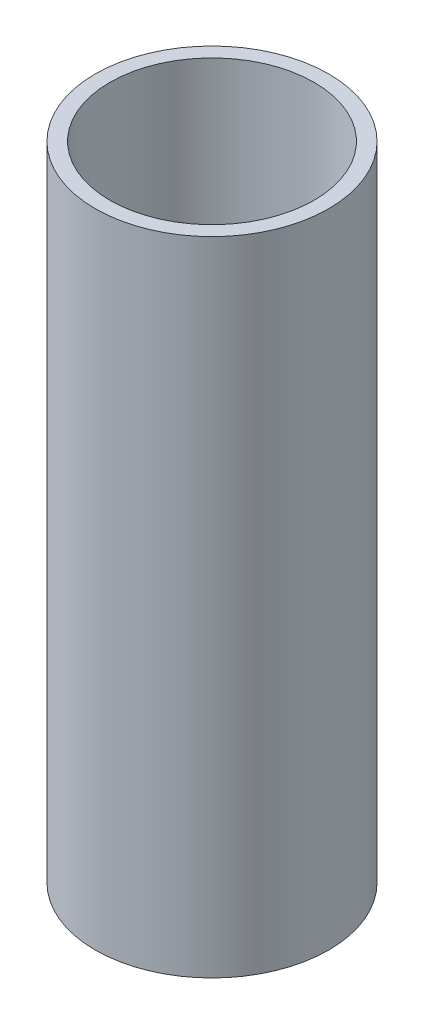
from build123d import *

# Parameters (mm, degrees)
ESQUISSE2_R        = 20
ESQUISSE2_R_2      = 17.5
BOSS_EXTRU_2_DEPTH = 105
BOSS_EXTRU_3_START = 5
ESQUISSE3_R        = 20
BOSS_EXTRU_3_DEPTH = 5


with BuildPart() as part:
    # Esquisse2 → Boss.-Extru.2 (new body)
    with BuildSketch(Plane(origin=(0, 0, 0), x_dir=(1, 0, 0), z_dir=(0, 1, 0))):
        with Locations(Location((0, 0, 0), (0, 0, 270))):
            Circle(ESQUISSE2_R)
        with Locations(Location((0, 0, 0), (0, 0, 270))):
            Circle(ESQUISSE2_R_2, mode=Mode.SUBTRACT)
    extrude(amount=BOSS_EXTRU_2_DEPTH)

    # Esquisse3 → Boss.-Extru.3 (add)
    with BuildSketch(Plane(origin=(0, 0, 0), x_dir=(-1, 0, 0), z_dir=(0, -1, 0)).offset(BOSS_EXTRU_3_START)):
        with Locations(Location((0, 0, 0), (0, 0, 90))):
            Circle(ESQUISSE3_R)
    extrude(amount=-BOSS_EXTRU_3_DEPTH)


solid = part.part
